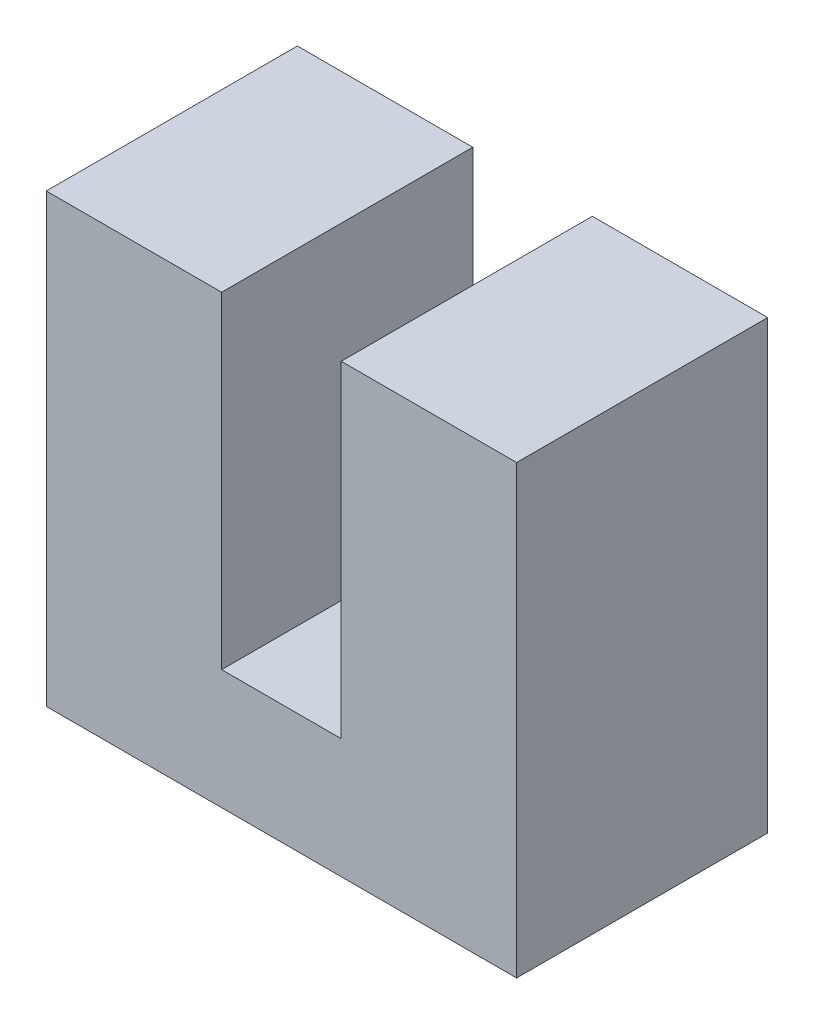
from build123d import *

# Parameters (mm, degrees)
BOSS_EXTRUDE1_DEPTH = 6.3


with BuildPart() as part:
    # Sketch1 → Boss-Extrude1 (new body)
    with BuildSketch(Plane.XY):
        Polygon((0, 0), (11.8, 0), (11.8, 11.2), (7.4, 11.2), (7.4, 3), (4.4, 3), (4.4, 11.2), (0, 11.2), align=None)
    extrude(amount=BOSS_EXTRUDE1_DEPTH)


solid = part.part
